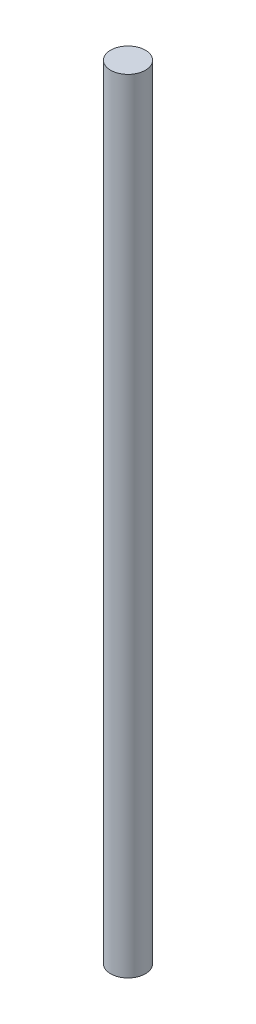
from build123d import *

# Parameters (mm, degrees)
SKETCH_1_R      = 1
EXTRUDE_1_DEPTH = 45


with BuildPart() as part:
    # 草图1 → 凸台-拉伸1 (new body)
    with BuildSketch(Plane(origin=(0, 0, 0), x_dir=(1, 0, 0), z_dir=(0, 1, 0))):
        with Locations(Location((0, 0, 0), (0, 0, 90))):
            Circle(SKETCH_1_R)
    extrude(amount=EXTRUDE_1_DEPTH)


solid = part.part
